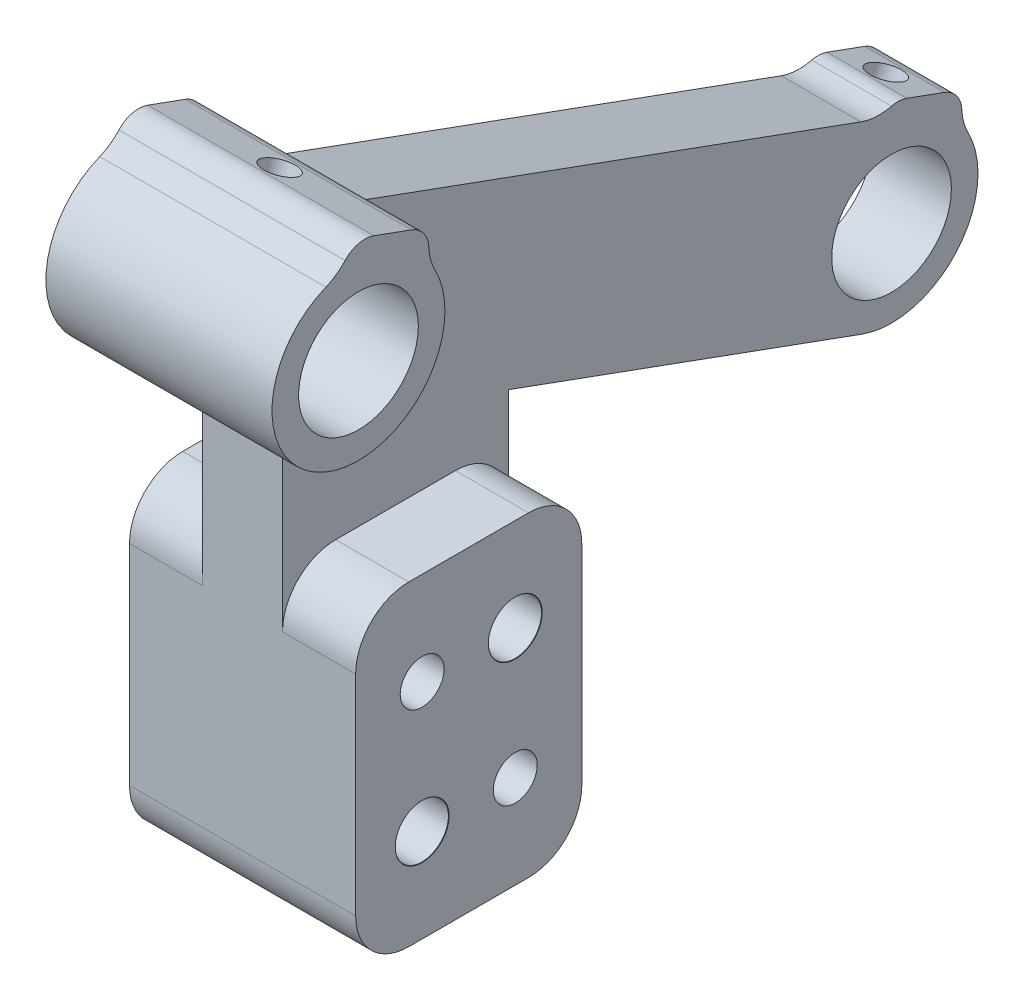
from build123d import *

# Parameters (mm, degrees)
BOSS_EXTRUDE1_DEPTH        = 3
BOSS_EXTRUDE1_DEPTH_BACK   = 3
SKETCH2_R                  = 4.5
BOSS_EXTRUDE2_DEPTH        = 8.5
BOSS_EXTRUDE2_DEPTH_BACK   = 8.5
SKETCH2_4_R                = 4.5
BOSS_EXTRUDE3_DEPTH        = 8.5
BOSS_EXTRUDE3_DEPTH_BACK   = 8.5
M3_TAPPED_HOLE1_REACH      = 52.91
M3_TAPPED_HOLE1_BORE_R     = 1.25
M3_TAPPED_HOLE2_REACH      = 52.91
M3_TAPPED_HOLE2_BORE_R     = 1.25
M4_TAPPED_HOLE1_AT_2_COUNT = 2
M4_TAPPED_HOLE1_AT_2_PITCH = 12
M5_TAPPED_HOLE2_AT_2_COUNT = 2
M5_TAPPED_HOLE2_AT_2_PITCH = 12


with BuildPart() as part:
    # Sketch2 → Boss-Extrude1 (new, two sides: drawn at the far end of the back side and taken through both)
    with BuildSketch(Plane(origin=(0, 0, 0), x_dir=(0, 0, -1), z_dir=(1, 0, 0)).offset(-BOSS_EXTRUDE1_DEPTH_BACK)):
        with BuildLine():
            Line((-6, -4.733334115), (20.564415122, -14.401990511))
            ThreePointArc((20.564415122, -14.401990511), (27.686806127, -12.56566856), (28.53576338, -5.259520223))
            ThreePointArc((28.53576338, -5.259520223), (28.211096751, -4.433651902), (28.076506478, -3.556524566))
            ThreePointArc((28.076506478, -3.556524566), (27.692579293, -2.458130667), (26.76223606, -1.759324035))
            Line((26.76223606, -1.759324035), (23.943158198, -0.733263605))
            ThreePointArc((23.943158198, -0.733263605), (23.371504837, -0.615809048), (22.790282203, -0.668376983))
            ThreePointArc((22.790282203, -0.668376983), (21.627836935, -0.773512852), (20.484530213, -0.538603739))
            Line((20.484530213, -0.538603739), (-17.527280829, 13.29656403))
            ThreePointArc((-17.527280829, 13.29656403), (-17.964807448, 14.234842894), (-18.812856048, 14.828652917))
            Line((-18.812856048, 14.828652917), (-21.63193391, 15.854713347))
            ThreePointArc((-21.63193391, 15.854713347), (-22.793802419, 15.917409512), (-23.793941695, 15.322774607))
            ThreePointArc((-23.793941695, 15.322774607), (-24.460850408, 14.737369045), (-25.2404174, 14.313408893))
            ThreePointArc((-25.2404174, 14.313408893), (-29.18584464, 7.14866092), (-23, 1.797461456))
            Line((-23, 1.797461456), (-23, -27.746794345))
            ThreePointArc((-23, -27.746794345), (-21.828427125, -30.57522147), (-19, -31.746794345))
            Line((-19, -31.746794345), (-10, -31.746794345))
            ThreePointArc((-10, -31.746794345), (-7.171572875, -30.57522147), (-6, -27.746794345))
            Line((-6, -27.746794345), (-6, -4.733334115))
        make_face()
        with Locations((22.787546054, -8.293988476)):
            Circle(SKETCH2_R, mode=Mode.SUBTRACT)
        with Locations((-22.787546054, 8.293988476)):
            Circle(SKETCH2_R, mode=Mode.SUBTRACT)
    extrude(amount=BOSS_EXTRUDE1_DEPTH + BOSS_EXTRUDE1_DEPTH_BACK)

    # Sketch2<4> → Boss-Extrude2 (add, two sides: drawn at the far end of the back side and taken through both)
    with BuildSketch(Plane(origin=(0, 0, 0), x_dir=(0, 0, -1), z_dir=(1, 0, 0)).offset(-BOSS_EXTRUDE2_DEPTH_BACK)):
        with BuildLine():
            ThreePointArc((-25.2404174, 14.313408893), (-29.18584464, 7.14866092), (-23, 1.797461456))
            ThreePointArc((-23, 1.797461456), (-17.276544623, 4.847415797), (-17.039328728, 11.328456728))
            ThreePointArc((-17.039328728, 11.328456728), (-17.363995357, 12.15432505), (-17.49858563, 13.031452385))
            ThreePointArc((-17.49858563, 13.031452385), (-17.508509891, 13.164486982), (-17.527280829, 13.29656403))
            ThreePointArc((-17.527280829, 13.29656403), (-17.964807448, 14.234842894), (-18.812856048, 14.828652917))
            Line((-18.812856048, 14.828652917), (-21.63193391, 15.854713347))
            ThreePointArc((-21.63193391, 15.854713347), (-22.793802419, 15.917409512), (-23.793941695, 15.322774607))
            ThreePointArc((-23.793941695, 15.322774607), (-24.460850408, 14.737369045), (-25.2404174, 14.313408893))
        make_face()
        with Locations((-22.787546054, 8.293988476)):
            Circle(SKETCH2_4_R, mode=Mode.SUBTRACT)
    extrude(amount=BOSS_EXTRUDE2_DEPTH + BOSS_EXTRUDE2_DEPTH_BACK)

    # Sketch2<5> → Boss-Extrude3 (add, two sides: drawn at the far end of the back side and taken through both)
    with BuildSketch(Plane(origin=(0, 0, 0), x_dir=(0, 0, -1), z_dir=(1, 0, 0)).offset(-BOSS_EXTRUDE3_DEPTH_BACK)):
        with BuildLine():
            Line((-6, -27.746794345), (-6, -12))
            ThreePointArc((-6, -12), (-7.171572875, -9.171572875), (-10, -8))
            Line((-10, -8), (-19, -8))
            ThreePointArc((-19, -8), (-21.828427125, -9.171572875), (-23, -12))
            Line((-23, -12), (-23, -27.746794345))
            ThreePointArc((-23, -27.746794345), (-21.828427125, -30.57522147), (-19, -31.746794345))
            Line((-19, -31.746794345), (-10, -31.746794345))
            ThreePointArc((-10, -31.746794345), (-7.171572875, -30.57522147), (-6, -27.746794345))
        make_face()
    extrude(amount=BOSS_EXTRUDE3_DEPTH + BOSS_EXTRUDE3_DEPTH_BACK)

    # M3 Tapped Hole1 bore → M3 Tapped Hole1 (cut, up to next)
    with BuildSketch(Plane(origin=(0, 7.047694656, -2.565151075), x_dir=(1, 0, 0), z_dir=(0, 0.9396926207859064, -0.3420201433256741)), mode=Mode.PRIVATE) as m3_tapped_hole1_sk1:
        with Locations((0, -24.25)):
            Circle(M3_TAPPED_HOLE1_BORE_R)
    m3_tapped_hole1_tool1 = extrude(m3_tapped_hole1_sk1.sketch, amount=-M3_TAPPED_HOLE1_REACH, mode=Mode.PRIVATE) & part.part
    add(m3_tapped_hole1_tool1.solids().sort_by_distance((0, 15.341683, 20.222395))[0], mode=Mode.SUBTRACT)

    # M3 Tapped Hole2 bore → M3 Tapped Hole2 (cut, up to next)
    with BuildSketch(Plane(origin=(0, 7.047694656, -2.565151075), x_dir=(1, 0, 0), z_dir=(0, 0.9396926207859064, -0.34202014332567404)), mode=Mode.PRIVATE) as m3_tapped_hole2_sk1:
        with Locations((0, 24.25)):
            Circle(M3_TAPPED_HOLE2_BORE_R)
    m3_tapped_hole2_tool1 = extrude(m3_tapped_hole2_sk1.sketch, amount=-M3_TAPPED_HOLE2_REACH, mode=Mode.PRIVATE) & part.part
    add(m3_tapped_hole2_tool1.solids().sort_by_distance((0, -1.246294, -25.352697))[0], mode=Mode.SUBTRACT)

    # Sketch10 → M4 Tapped Hole1 (revolve, cut)
    with BuildSketch(Plane(origin=(-8.5, -15, 18), x_dir=(0, 0, 1), z_dir=(0, 1, 0))):
        Polygon((0, 0), (0, 17), (1.65, 17), (1.65, 8), (2, 8), (2, 0.025), (2.025, 0), align=None)
    m4_tapped_hole1 = revolve(axis=Axis((-14.85, -15, 18), (1, 0, 0)), mode=Mode.SUBTRACT)

    # M4 Tapped Hole1 at 2: M4 Tapped Hole1 ×2
    with Locations(*[Vector(0, -0.8122328620674102, -0.5833333333333383) * (i * M4_TAPPED_HOLE1_AT_2_PITCH) for i in range(1, M4_TAPPED_HOLE1_AT_2_COUNT)]):
        add(m4_tapped_hole1, mode=Mode.SUBTRACT)

    # Sketch12 → M5 Tapped Hole2 (revolve, cut)
    with BuildSketch(Plane(origin=(8.5, -15, 11), x_dir=(0, 0, -1), z_dir=(0, 1, 0))):
        Polygon((0, 0), (0, 17), (1.65, 17), (1.65, 8), (2, 8), (2, 0.025), (2.025, 0), align=None)
    m5_tapped_hole2 = revolve(axis=Axis((14.85, -15, 11), (-1, 0, 0)), mode=Mode.SUBTRACT)

    # M5 Tapped Hole2 at 2: M5 Tapped Hole2 ×2
    with Locations(*[Vector(0, -0.8122328620674105, 0.5833333333333377) * (i * M5_TAPPED_HOLE2_AT_2_PITCH) for i in range(1, M5_TAPPED_HOLE2_AT_2_COUNT)]):
        add(m5_tapped_hole2, mode=Mode.SUBTRACT)


solid = part.part
